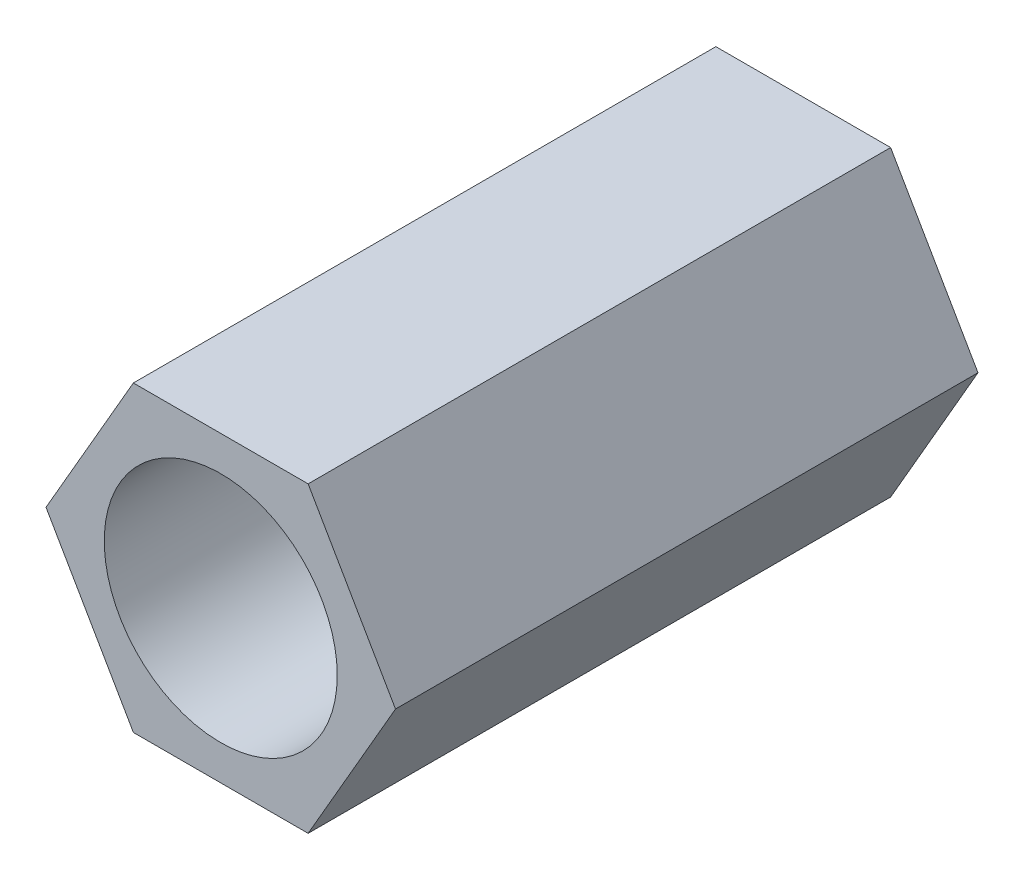
from build123d import *

# Parameters (mm, degrees)
SKETCH1_R           = 2
BOSS_EXTRUDE1_DEPTH = 10


with BuildPart() as part:
    # Sketch1 → Boss-Extrude1 (new body)
    with BuildSketch(Plane.XY):
        Polygon((-3, 0), (-1.5, -2.598076211), (1.5, -2.598076211), (3, 0), (1.5, 2.598076211), (-1.5, 2.598076211), align=None)
        Circle(SKETCH1_R, mode=Mode.SUBTRACT)
    extrude(amount=BOSS_EXTRUDE1_DEPTH)


solid = part.part
